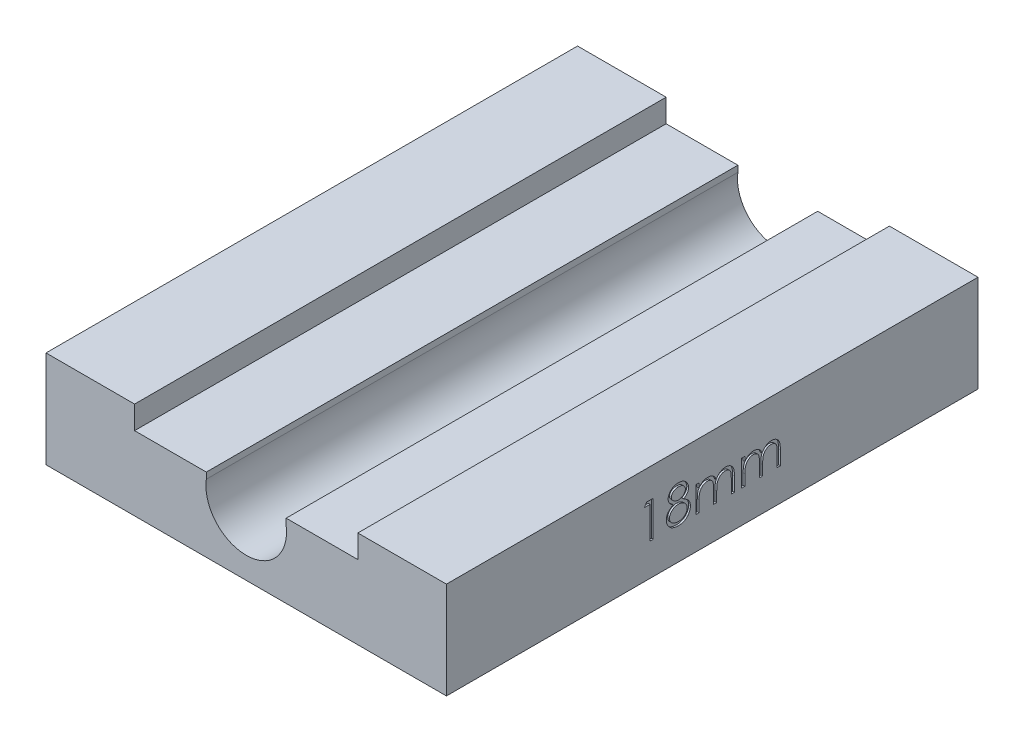
from build123d import *

# Parameters (mm, degrees)
BOSS_EXTRUDE1_DEPTH = 120
CUT_EXTRUDE1_DEPTH  = 0.4


with BuildPart() as part:
    # Sketch1 → Boss-Extrude1 (new body)
    with BuildSketch(Plane.XY):
        with BuildLine():
            ThreePointArc((9.1, 0), (-0.640273766, -9.077447301), (-9.00990099, 1.277373927))
            Line((-9.00990099, 1.277373927), (-9.00990099, 2.669343418))
            Line((-9.00990099, 2.669343418), (-25.2, 2.669343418))
            Line((-25.2, 2.669343418), (-25.2, 7.869343418))
            Line((-25.2, 7.869343418), (-45.2, 7.869343418))
            Line((-45.2, 7.869343418), (-45.2, -14))
            Line((-45.2, -14), (45.2, -14))
            Line((45.2, -14), (45.2, 7.869343418))
            Line((45.2, 7.869343418), (25.2, 7.869343418))
            Line((25.2, 7.869343418), (25.2, 2.669343418))
            Line((25.2, 2.669343418), (9.00990099, 2.669343418))
            Line((9.00990099, 2.669343418), (9.00990099, 1.277373927))
            ThreePointArc((9.00990099, 1.277373927), (9.077447301, 0.640273766), (9.1, 0))
        make_face()
    extrude(amount=BOSS_EXTRUDE1_DEPTH)

    # Sketch2 → Cut-Extrude1 (cut)
    # profile 1 of 4: a face of its own
    with BuildSketch(Plane(origin=(45.2, 0, 0), x_dir=(0, 0, -1), z_dir=(1, 0, 0))):
        Polygon((-74.817883643, 1.310632471), (-73.338716976, 1.310632471), (-73.338716976, -6.689367529), (-74.056665694, -6.689367529), (-74.056665694, 0.49011965), (-75.287434925, 0.49011965), align=None)
    # profile 2 of 4: a face of its own
    with BuildSketch(Plane(origin=(45.2, 0, 0), x_dir=(0, 0, -1), z_dir=(1, 0, 0))):
        with BuildLine():
            add(Edge.make_bspline(
                [(-66.474934925, -2.23263676), (-66.409452531, -2.26678066), (-66.281739995, -2.333372666), (-66.099849233, -2.440597415), (-65.933620659, -2.553605335), (-65.778442232, -2.667058728), (-65.637040287, -2.785302502), (-65.510995915, -2.908806859), (-65.397195641, -3.03448902), (-65.297934421, -3.164477226), (-65.210627365, -3.298426138), (-65.135171056, -3.436687334), (-65.070674593, -3.578957811), (-65.019559304, -3.726790565), (-64.977452352, -3.878014021), (-64.94847954, -4.034580836), (-64.932898014, -4.19545933), (-64.929952154, -4.304186876), (-64.928460566, -4.359239324)],
                knots=[0, 0, 0, 0, 1.272397273, 2.481599622, 3.635517121, 4.734568067, 5.792894095, 6.808321871, 7.773003508, 8.711915296, 9.623354172, 10.525449501, 11.423591555, 12.311487226, 13.218079475, 14.126165749, 15.051214107, 16, 16, 16, 16], degree=3))
            add(Edge.make_bspline(
                [(-64.928460566, -4.359239324), (-64.930223813, -4.436262713), (-64.93371394, -4.5887209), (-64.964113903, -4.813740584), (-65.009629283, -5.032281799), (-65.076096739, -5.244296636), (-65.162298776, -5.448615203), (-65.268531544, -5.6454124), (-65.388785727, -5.837913678), (-65.485362274, -5.956358024), (-65.534229796, -6.016290606)],
                knots=[0, 0, 0, 0, 1.025265484, 2.029385089, 3.018602448, 3.995076438, 4.983346944, 5.966715145, 6.97116228, 8, 8, 8, 8], degree=3))
            add(Edge.make_bspline(
                [(-65.534229796, -6.016290606), (-65.597856023, -6.086219233), (-65.724322231, -6.225212359), (-65.940968922, -6.405671353), (-66.178733228, -6.557327111), (-66.436695131, -6.680920013), (-66.714165077, -6.777116262), (-67.011083945, -6.846242017), (-67.32803058, -6.885836141), (-67.545871657, -6.891559546), (-67.657627232, -6.894495735)],
                knots=[0, 0, 0, 0, 0.954267603, 1.896743057, 2.838368354, 3.796610408, 4.779680527, 5.799409237, 6.871065594, 8, 8, 8, 8], degree=3))
            add(Edge.make_bspline(
                [(-67.657627232, -6.894495735), (-67.765086406, -6.891861499), (-67.974191044, -6.886735545), (-68.278551907, -6.852005416), (-68.562261781, -6.79114172), (-68.82697028, -6.707839756), (-69.071081579, -6.59947352), (-69.293900096, -6.464597157), (-69.498640604, -6.308639575), (-69.679089686, -6.127121682), (-69.839291844, -5.932703688), (-69.980018822, -5.73212858), (-70.096988145, -5.525378049), (-70.196021505, -5.315534924), (-70.271834129, -5.099658), (-70.324342038, -4.87885797), (-70.357689041, -4.6535205), (-70.362125921, -4.50144815), (-70.364358002, -4.424944452)],
                knots=[0, 0, 0, 0, 1.256902934, 2.445805442, 3.576955095, 4.645999104, 5.686449165, 6.692658513, 7.68621702, 8.689161843, 9.678783111, 10.630372946, 11.551080876, 12.453998257, 13.34127905, 14.221779781, 15.105423033, 16, 16, 16, 16], degree=3))
            add(Edge.make_bspline(
                [(-70.364358002, -4.424944452), (-70.363037131, -4.368809156), (-70.360426624, -4.257865998), (-70.342358399, -4.093958962), (-70.313310487, -3.934424939), (-70.273860301, -3.778674668), (-70.220395097, -3.627842045), (-70.15584165, -3.481212391), (-70.080568616, -3.338620165), (-69.993525953, -3.19928558), (-69.892264184, -3.06516098), (-69.777604413, -2.933970135), (-69.647254999, -2.807748725), (-69.502666064, -2.684954611), (-69.345489974, -2.563409528), (-69.17164419, -2.449682148), (-68.985737292, -2.335721086), (-68.853610651, -2.26758777), (-68.785832361, -2.23263676)],
                knots=[0, 0, 0, 0, 0.941657376, 1.861047343, 2.762797495, 3.66048619, 4.553285746, 5.444104102, 6.34607688, 7.256116206, 8.197091036, 9.162375105, 10.176350973, 11.237807142, 12.343728897, 13.50695164, 14.721116704, 16, 16, 16, 16], degree=3))
            add(Edge.make_bspline(
                [(-68.785832361, -2.23263676), (-68.878612646, -2.182043003), (-69.058261246, -2.084079329), (-69.296134255, -1.904086629), (-69.50045568, -1.709143053), (-69.66560932, -1.495132093), (-69.795602984, -1.268739237), (-69.884788366, -1.031380946), (-69.945123187, -0.787458401), (-69.951099934, -0.620815666), (-69.954101591, -0.53712394)],
                knots=[0, 0, 0, 0, 1.166880483, 2.259407225, 3.286803203, 4.280235371, 5.237608625, 6.161067461, 7.076446754, 8, 8, 8, 8], degree=3))
            add(Edge.make_bspline(
                [(-69.954101591, -0.53712394), (-69.950363479, -0.451872378), (-69.942849222, -0.28050187), (-69.882087346, -0.02540216), (-69.783070051, 0.225149989), (-69.648393487, 0.469940189), (-69.480651278, 0.700683537), (-69.279402031, 0.907634272), (-69.049451638, 1.08891766), (-68.791947942, 1.241091769), (-68.514836546, 1.364940132), (-68.222457748, 1.450376527), (-67.919905764, 1.506230508), (-67.71396812, 1.51255429), (-67.609550309, 1.515760676)],
                knots=[0, 0, 0, 0, 0.888701115, 1.786444228, 2.72001202, 3.692817113, 4.693886446, 5.687152267, 6.695133018, 7.739871481, 8.800368666, 9.853104506, 10.91144658, 12, 12, 12, 12], degree=3))
            add(Edge.make_bspline(
                [(-67.609550309, 1.515760676), (-67.507827304, 1.512454749), (-67.307241125, 1.505935837), (-67.012396262, 1.45156583), (-66.730282256, 1.360755499), (-66.461871973, 1.237561846), (-66.211970562, 1.085820267), (-65.991165283, 0.90204684), (-65.796119382, 0.69600901), (-65.634783624, 0.465335631), (-65.501839876, 0.221486046), (-65.409266388, -0.033651145), (-65.34994759, -0.294563279), (-65.342465615, -0.471107288), (-65.338716976, -0.559559837)],
                knots=[0, 0, 0, 0, 1.072916533, 2.115669174, 3.151510826, 4.193348718, 5.225979165, 6.227137561, 7.216255879, 8.211077061, 9.189680878, 10.138522389, 11.067357538, 12, 12, 12, 12], degree=3))
            add(Edge.make_bspline(
                [(-65.338716976, -0.559559837), (-65.341995972, -0.64636364), (-65.348435733, -0.816841376), (-65.402607023, -1.065359137), (-65.493837454, -1.298095226), (-65.618395541, -1.517690545), (-65.780739513, -1.72016254), (-65.978702331, -1.908085899), (-66.21070571, -2.083004364), (-66.385016307, -2.181716054), (-66.474934925, -2.23263676)],
                knots=[0, 0, 0, 0, 0.975232327, 1.915300861, 2.843280834, 3.77672583, 4.742871857, 5.749627742, 6.839139064, 8, 8, 8, 8], degree=3))
        make_face()
        with BuildLine():
            add(Edge.make_bspline(
                [(-67.649614412, 0.695247855), (-67.70573054, 0.693758848), (-67.815518222, 0.690845699), (-67.976498042, 0.675625958), (-68.129577739, 0.646018605), (-68.276356712, 0.606615836), (-68.414822568, 0.553386149), (-68.546855836, 0.490768985), (-68.670209412, 0.414640835), (-68.786372391, 0.329243811), (-68.890945589, 0.235317169), (-68.983755993, 0.13745724), (-69.060848826, 0.033742058), (-69.126314219, -0.073248478), (-69.17381483, -0.186689795), (-69.209390382, -0.303103913), (-69.233439277, -0.423961934), (-69.235241311, -0.506559672), (-69.236152873, -0.548341888)],
                knots=[0, 0, 0, 0, 1.203892937, 2.355340988, 3.463153438, 4.544400666, 5.610487187, 6.640501085, 7.674077295, 8.714426146, 9.728707835, 10.68524104, 11.601827946, 12.495867327, 13.368432065, 14.231010473, 15.105153427, 16, 16, 16, 16], degree=3))
            add(Edge.make_bspline(
                [(-69.236152873, -0.548341888), (-69.234581749, -0.59012591), (-69.231476982, -0.67269714), (-69.20746526, -0.794630548), (-69.171678164, -0.914451432), (-69.115333795, -1.029310657), (-69.047753547, -1.143192621), (-68.964344459, -1.253251103), (-68.864940967, -1.359869126), (-68.752878246, -1.462139848), (-68.630794731, -1.55790845), (-68.501459775, -1.64104715), (-68.366496595, -1.710610832), (-68.227291865, -1.768506614), (-68.082426843, -1.813512185), (-67.932789189, -1.84544052), (-67.778353755, -1.865285084), (-67.673712428, -1.867655418), (-67.620768258, -1.868854709)],
                knots=[0, 0, 0, 0, 0.873023192, 1.725219244, 2.590779336, 3.480155217, 4.391973325, 5.357036234, 6.360879153, 7.436073238, 8.526419356, 9.601555421, 10.645666583, 11.697338044, 12.750135903, 13.812665442, 14.89329948, 16, 16, 16, 16], degree=3))
            add(Edge.make_bspline(
                [(-67.620768258, -1.868854709), (-67.552768021, -1.866859584), (-67.41743918, -1.86288904), (-67.217943565, -1.825972071), (-67.023971807, -1.767901402), (-66.837597168, -1.688450051), (-66.66364383, -1.588729228), (-66.508580817, -1.469339473), (-66.373730777, -1.333037536), (-66.260495096, -1.18194534), (-66.172701161, -1.02114171), (-66.104354172, -0.859769612), (-66.064442823, -0.69610737), (-66.059236955, -0.586468595), (-66.056665694, -0.532316247)],
                knots=[0, 0, 0, 0, 1.076279235, 2.141928126, 3.20205304, 4.278698113, 5.344010996, 6.36967002, 7.368914609, 8.37248503, 9.349703398, 10.264243087, 11.142681841, 12, 12, 12, 12], degree=3))
            add(Edge.make_bspline(
                [(-66.056665694, -0.532316247), (-66.05788146, -0.494309308), (-66.060294581, -0.418870981), (-66.080180423, -0.307469003), (-66.11303947, -0.198601384), (-66.15752651, -0.091368765), (-66.216063184, 0.012724337), (-66.285467041, 0.115314252), (-66.369774473, 0.214093141), (-66.464394892, 0.311362966), (-66.571698683, 0.401383592), (-66.691479054, 0.480548643), (-66.823121912, 0.547776887), (-66.966630369, 0.602379755), (-67.12147591, 0.64339084), (-67.286945337, 0.674102492), (-67.464418359, 0.691412461), (-67.586543504, 0.693941662), (-67.649614412, 0.695247855)],
                knots=[0, 0, 0, 0, 0.814439003, 1.616544685, 2.417341072, 3.248991801, 4.09997495, 4.973547432, 5.9003056, 6.880240646, 7.880314356, 8.896779544, 9.951930927, 11.043077905, 12.18215768, 13.381699519, 14.647792085, 16, 16, 16, 16], degree=3))
        make_face(mode=Mode.SUBTRACT)
        with BuildLine():
            add(Edge.make_bspline(
                [(-67.603140053, -2.689367529), (-67.674284706, -2.690632995), (-67.813853155, -2.693115531), (-68.018326133, -2.720748675), (-68.21456194, -2.759215859), (-68.401898938, -2.817572061), (-68.580258016, -2.893449753), (-68.750604719, -2.984728702), (-68.911635872, -3.092626857), (-69.061127818, -3.215773407), (-69.197638286, -3.348480731), (-69.317405829, -3.488965611), (-69.419114447, -3.634617114), (-69.50101902, -3.787285067), (-69.568245836, -3.943736749), (-69.612391842, -4.107868395), (-69.640692897, -4.276524654), (-69.644493197, -4.391176308), (-69.646409284, -4.448982914)],
                knots=[0, 0, 0, 0, 1.140299081, 2.23698856, 3.303958914, 4.344563908, 5.37730929, 6.408454204, 7.439741482, 8.480804886, 9.510774543, 10.48932336, 11.43758569, 12.353841022, 13.263987381, 14.161954604, 15.073269652, 16, 16, 16, 16], degree=3))
            add(Edge.make_bspline(
                [(-69.646409284, -4.448982914), (-69.643293264, -4.520824985), (-69.637111153, -4.663357976), (-69.588067407, -4.874016424), (-69.509357611, -5.077950264), (-69.399585689, -5.273497585), (-69.263659809, -5.456240685), (-69.096513597, -5.615529315), (-68.908534539, -5.757064123), (-68.693362301, -5.871533913), (-68.458325807, -5.962950725), (-68.20348757, -6.025935783), (-67.932504898, -6.067630525), (-67.745397259, -6.071832082), (-67.649614412, -6.073982914)],
                knots=[0, 0, 0, 0, 0.898778495, 1.783155532, 2.693654817, 3.627872908, 4.583023416, 5.533784346, 6.509005473, 7.520592997, 8.575161974, 9.658835044, 10.801527049, 12, 12, 12, 12], degree=3))
            add(Edge.make_bspline(
                [(-67.649614412, -6.073982914), (-67.574756428, -6.072545638), (-67.428909071, -6.069745362), (-67.216141187, -6.045026975), (-67.015353648, -6.005827833), (-66.826935823, -5.948814014), (-66.648778475, -5.879214068), (-66.483902237, -5.789677881), (-66.328065603, -5.687844), (-66.188947608, -5.567025357), (-66.062243131, -5.437929369), (-65.951767034, -5.301266413), (-65.85586406, -5.160750682), (-65.780593304, -5.013206717), (-65.72041901, -4.861465198), (-65.67716517, -4.704126887), (-65.650476678, -4.540709211), (-65.647777488, -4.429854192), (-65.646409284, -4.373662401)],
                knots=[0, 0, 0, 0, 1.224942928, 2.386581632, 3.501229538, 4.569074225, 5.605009692, 6.626002462, 7.634866581, 8.645888296, 9.63523824, 10.59253846, 11.518950513, 12.414518923, 13.29783783, 14.186679152, 15.080837789, 16, 16, 16, 16], degree=3))
            add(Edge.make_bspline(
                [(-65.646409284, -4.373662401), (-65.648479795, -4.319085623), (-65.65256248, -4.211469749), (-65.678474918, -4.052003402), (-65.723996923, -3.897939827), (-65.786459544, -3.747425528), (-65.86961603, -3.603510212), (-65.967547162, -3.462444678), (-66.085705147, -3.328144233), (-66.219219653, -3.199565728), (-66.364725849, -3.080672615), (-66.519393608, -2.975496755), (-66.682032379, -2.88692049), (-66.852298004, -2.814882786), (-67.029812417, -2.758225713), (-67.214445054, -2.718646295), (-67.406412082, -2.693732917), (-67.536823215, -2.690839098), (-67.603140053, -2.689367529)],
                knots=[0, 0, 0, 0, 0.917430815, 1.809013306, 2.70690318, 3.612392954, 4.541220862, 5.495268465, 6.494511384, 7.542276156, 8.608045339, 9.649016899, 10.681629292, 11.715607085, 12.752076957, 13.808767841, 14.885711793, 16, 16, 16, 16], degree=3))
        make_face(mode=Mode.SUBTRACT)
    # profile 3 of 4: a face of its own
    with BuildSketch(Plane(origin=(45.2, 0, 0), x_dir=(0, 0, -1), z_dir=(1, 0, 0))):
        with BuildLine():
            Line((-63.697691335, -0.843213683), (-62.979742617, -0.843213683))
            Line((-62.979742617, -0.843213683), (-62.979742617, -1.859239324))
            add(Edge.make_bspline(
                [(-62.979742617, -1.859239324), (-62.915093589, -1.770353377), (-62.791219852, -1.600039382), (-62.588098361, -1.375604447), (-62.385181532, -1.185140093), (-62.239048088, -1.085156386), (-62.168845181, -1.03712394)],
                knots=[0, 0, 0, 0, 1.134379233, 2.173579362, 3.122582517, 4, 4, 4, 4], degree=3))
            add(Edge.make_bspline(
                [(-62.168845181, -1.03712394), (-62.073154525, -0.991397391), (-61.88344504, -0.900743189), (-61.58305824, -0.808780768), (-61.275687567, -0.752266251), (-61.068125935, -0.744537397), (-60.963716976, -0.740649581)],
                knots=[0, 0, 0, 0, 1.014936303, 2.012140481, 3.000054389, 4, 4, 4, 4], degree=3))
            add(Edge.make_bspline(
                [(-60.963716976, -0.740649581), (-60.893104412, -0.743038817), (-60.753365946, -0.747766986), (-60.546316597, -0.778532781), (-60.345496913, -0.831712605), (-60.152093417, -0.905786489), (-59.969874722, -0.995493202), (-59.802813698, -1.100749677), (-59.652815508, -1.218914421), (-59.519955963, -1.35532341), (-59.400483904, -1.513807064), (-59.290589398, -1.698639633), (-59.189046055, -1.91397143), (-59.132768778, -2.070237809), (-59.103140053, -2.152508555)],
                knots=[0, 0, 0, 0, 1.009824226, 1.998387844, 2.986035974, 3.974953746, 4.955485308, 5.885931332, 6.793869504, 7.679848016, 8.601185859, 9.625726857, 10.749998409, 12, 12, 12, 12], degree=3))
            add(Edge.make_bspline(
                [(-59.103140053, -2.152508555), (-59.07180005, -2.095995597), (-59.010127325, -1.984786031), (-58.906571583, -1.827395717), (-58.798073763, -1.680180193), (-58.683709207, -1.543022652), (-58.56388158, -1.416600411), (-58.438026951, -1.300495493), (-58.306861736, -1.19420929), (-58.124479473, -1.070042068), (-57.887193514, -0.938153654), (-57.58802068, -0.823802925), (-57.276820288, -0.753137488), (-57.065579835, -0.744839722), (-56.958909284, -0.740649581)],
                knots=[0, 0, 0, 0, 0.86119277, 1.694706429, 2.50939023, 3.298075842, 4.073795165, 4.829715201, 5.57930267, 6.321991688, 7.768977793, 9.186738141, 10.579381044, 12, 12, 12, 12], degree=3))
            add(Edge.make_bspline(
                [(-56.958909284, -0.740649581), (-56.860894512, -0.744346086), (-56.669070086, -0.751580504), (-56.389807764, -0.808388443), (-56.129369352, -0.905937351), (-55.888278892, -1.039042806), (-55.670770747, -1.206309511), (-55.481704898, -1.405323997), (-55.322229782, -1.634678564), (-55.218050034, -1.850431681), (-55.147386573, -2.040912441), (-55.103818037, -2.203212536), (-55.065327305, -2.381844657), (-55.033370173, -2.577022397), (-55.010013483, -2.789435216), (-54.99270899, -3.018735504), (-54.980996822, -3.265101474), (-54.980169228, -3.43507976), (-54.979742617, -3.522700863)],
                knots=[0, 0, 0, 0, 1.209669288, 2.367440248, 3.500751976, 4.631527125, 5.755587489, 6.87532382, 8.007944318, 9.190864318, 9.82315674, 10.514484317, 11.263564316, 12.079023757, 12.955305781, 13.901327259, 14.918167583, 16, 16, 16, 16], degree=3))
            Line((-54.979742617, -3.522700863), (-54.979742617, -6.689367529))
            Line((-54.979742617, -6.689367529), (-55.697691335, -6.689367529))
            Line((-55.697691335, -6.689367529), (-55.697691335, -3.519495735))
            add(Edge.make_bspline(
                [(-55.697691335, -3.519495735), (-55.697869353, -3.444705851), (-55.698211477, -3.30097107), (-55.704368349, -3.094679753), (-55.715969067, -2.906637793), (-55.729533956, -2.737101592), (-55.748376949, -2.58567579), (-55.772710507, -2.452664547), (-55.798488061, -2.33702155), (-55.841313183, -2.20882487), (-55.909765507, -2.067407246), (-56.014034033, -1.914896215), (-56.145394276, -1.782140101), (-56.297074634, -1.666898234), (-56.469756793, -1.573198482), (-56.66007616, -1.506281889), (-56.866851135, -1.464858167), (-57.009988937, -1.460730131), (-57.083909284, -1.458598299)],
                knots=[0, 0, 0, 0, 1.253487763, 2.409012846, 3.458416907, 4.410876679, 5.259312806, 6.014470957, 6.676830364, 7.243083969, 8.276244668, 9.299465089, 10.325150304, 11.392391894, 12.482080715, 13.603491619, 14.762376348, 16, 16, 16, 16], degree=3))
            add(Edge.make_bspline(
                [(-57.083909284, -1.458598299), (-57.174583465, -1.46183523), (-57.353790119, -1.468232636), (-57.615379802, -1.533544346), (-57.866742126, -1.63201349), (-58.100376715, -1.77471625), (-58.315297379, -1.945706795), (-58.5002107, -2.149020157), (-58.652969982, -2.379031419), (-58.756407641, -2.591938167), (-58.821754615, -2.78318261), (-58.864901851, -2.950262318), (-58.898463889, -3.140163044), (-58.929939384, -3.351608737), (-58.950482762, -3.586054864), (-58.969153328, -3.842416923), (-58.977886728, -4.121465973), (-58.979108348, -4.314898405), (-58.979742617, -4.415329068)],
                knots=[0, 0, 0, 0, 1.090531906, 2.155305635, 3.229839962, 4.33261226, 5.44038871, 6.529323825, 7.629011124, 8.757537029, 9.370236727, 10.061839251, 10.834451254, 11.692844982, 12.636905849, 13.66920014, 14.789842145, 16, 16, 16, 16], degree=3))
            Line((-58.979742617, -4.415329068), (-58.979742617, -6.689367529))
            Line((-58.979742617, -6.689367529), (-59.697691335, -6.689367529))
            Line((-59.697691335, -6.689367529), (-59.697691335, -3.716611119))
            add(Edge.make_bspline(
                [(-59.697691335, -3.716611119), (-59.697872891, -3.632740676), (-59.698222188, -3.471382374), (-59.704339485, -3.239991116), (-59.715966049, -3.029520076), (-59.729407302, -2.840213873), (-59.748744853, -2.67241655), (-59.770710023, -2.525228532), (-59.796649705, -2.399018815), (-59.839598012, -2.260588221), (-59.905231083, -2.108083254), (-60.010804253, -1.945475206), (-60.142478722, -1.803148126), (-60.296926439, -1.681642415), (-60.470653712, -1.581204744), (-60.662615771, -1.508839597), (-60.871084143, -1.466726935), (-61.014804614, -1.461358942), (-61.088716976, -1.458598299)],
                knots=[0, 0, 0, 0, 1.320475261, 2.540461679, 3.643808994, 4.639130445, 5.527981419, 6.302341397, 6.981980563, 7.553956391, 8.582137848, 9.585246428, 10.591171744, 11.620968678, 12.668337649, 13.738356861, 14.836885341, 16, 16, 16, 16], degree=3))
            add(Edge.make_bspline(
                [(-61.088716976, -1.458598299), (-61.175611174, -1.462096493), (-61.348788224, -1.46906827), (-61.603192726, -1.531820896), (-61.848874288, -1.630115924), (-62.0819136, -1.766481225), (-62.296025939, -1.935393404), (-62.483473407, -2.134056023), (-62.641056322, -2.359996671), (-62.745586185, -2.570658423), (-62.813011269, -2.757111623), (-62.857800605, -2.915628075), (-62.896291178, -3.091628642), (-62.924894657, -3.285656325), (-62.952507035, -3.496447397), (-62.965833456, -3.725051945), (-62.978797027, -3.97127386), (-62.979419689, -4.141268249), (-62.979742617, -4.229431632)],
                knots=[0, 0, 0, 0, 1.098833095, 2.189935336, 3.297829714, 4.440610912, 5.596351641, 6.740013378, 7.886572111, 9.072425424, 9.705826452, 10.395263256, 11.156850408, 11.985370555, 12.878090359, 13.847760091, 14.883794034, 16, 16, 16, 16], degree=3))
            Line((-62.979742617, -4.229431632), (-62.979742617, -6.689367529))
            Line((-62.979742617, -6.689367529), (-63.697691335, -6.689367529))
            Line((-63.697691335, -6.689367529), (-63.697691335, -0.843213683))
        make_face()
    # profile 4 of 4: a face of its own
    with BuildSketch(Plane(origin=(45.2, 0, 0), x_dir=(0, 0, -1), z_dir=(1, 0, 0))):
        with BuildLine():
            Line((-53.338716976, -0.843213683), (-52.620768258, -0.843213683))
            Line((-52.620768258, -0.843213683), (-52.620768258, -1.859239324))
            add(Edge.make_bspline(
                [(-52.620768258, -1.859239324), (-52.55611923, -1.770353377), (-52.432245493, -1.600039382), (-52.229124002, -1.375604447), (-52.026207173, -1.185140093), (-51.880073729, -1.085156386), (-51.809870822, -1.03712394)],
                knots=[0, 0, 0, 0, 1.134379233, 2.173579362, 3.122582517, 4, 4, 4, 4], degree=3))
            add(Edge.make_bspline(
                [(-51.809870822, -1.03712394), (-51.714180166, -0.991397391), (-51.524470681, -0.900743189), (-51.224083881, -0.808780768), (-50.916713208, -0.752266251), (-50.709151576, -0.744537397), (-50.604742617, -0.740649581)],
                knots=[0, 0, 0, 0, 1.014936303, 2.012140481, 3.000054389, 4, 4, 4, 4], degree=3))
            add(Edge.make_bspline(
                [(-50.604742617, -0.740649581), (-50.534130053, -0.743038817), (-50.394391587, -0.747766986), (-50.187342238, -0.778532781), (-49.986522554, -0.831712605), (-49.793119058, -0.905786489), (-49.610900363, -0.995493202), (-49.44383934, -1.100749677), (-49.293841149, -1.218914421), (-49.160981604, -1.35532341), (-49.041509545, -1.513807064), (-48.931615039, -1.698639633), (-48.830071696, -1.91397143), (-48.773794419, -2.070237809), (-48.744165694, -2.152508555)],
                knots=[0, 0, 0, 0, 1.009824226, 1.998387844, 2.986035974, 3.974953746, 4.955485308, 5.885931332, 6.793869504, 7.679848016, 8.601185859, 9.625726857, 10.749998409, 12, 12, 12, 12], degree=3))
            add(Edge.make_bspline(
                [(-48.744165694, -2.152508555), (-48.712825691, -2.095995597), (-48.651152966, -1.984786031), (-48.547597224, -1.827395717), (-48.439099404, -1.680180193), (-48.324734848, -1.543022652), (-48.204907221, -1.416600411), (-48.079052592, -1.300495493), (-47.947887377, -1.19420929), (-47.765505114, -1.070042068), (-47.528219155, -0.938153654), (-47.229046321, -0.823802925), (-46.917845929, -0.753137488), (-46.706605476, -0.744839722), (-46.599934925, -0.740649581)],
                knots=[0, 0, 0, 0, 0.86119277, 1.694706429, 2.50939023, 3.298075842, 4.073795165, 4.829715201, 5.57930267, 6.321991688, 7.768977793, 9.186738141, 10.579381044, 12, 12, 12, 12], degree=3))
            add(Edge.make_bspline(
                [(-46.599934925, -0.740649581), (-46.501920153, -0.744346086), (-46.310095727, -0.751580504), (-46.030833405, -0.808388443), (-45.770394993, -0.905937351), (-45.529304533, -1.039042806), (-45.311796388, -1.206309511), (-45.122730539, -1.405323997), (-44.963255423, -1.634678564), (-44.859075675, -1.850431681), (-44.788412214, -2.040912441), (-44.744843678, -2.203212536), (-44.706352946, -2.381844657), (-44.674395814, -2.577022397), (-44.651039124, -2.789435216), (-44.633734631, -3.018735504), (-44.622022463, -3.265101474), (-44.621194869, -3.43507976), (-44.620768258, -3.522700863)],
                knots=[0, 0, 0, 0, 1.209669288, 2.367440248, 3.500751976, 4.631527125, 5.755587489, 6.87532382, 8.007944318, 9.190864318, 9.82315674, 10.514484317, 11.263564316, 12.079023757, 12.955305781, 13.901327259, 14.918167583, 16, 16, 16, 16], degree=3))
            Line((-44.620768258, -3.522700863), (-44.620768258, -6.689367529))
            Line((-44.620768258, -6.689367529), (-45.338716976, -6.689367529))
            Line((-45.338716976, -6.689367529), (-45.338716976, -3.519495735))
            add(Edge.make_bspline(
                [(-45.338716976, -3.519495735), (-45.338894994, -3.444705851), (-45.339237118, -3.30097107), (-45.34539399, -3.094679753), (-45.356994708, -2.906637793), (-45.370559597, -2.737101592), (-45.38940259, -2.58567579), (-45.413736148, -2.452664547), (-45.439513702, -2.33702155), (-45.482338824, -2.20882487), (-45.550791148, -2.067407246), (-45.655059674, -1.914896215), (-45.786419917, -1.782140101), (-45.938100275, -1.666898234), (-46.110782434, -1.573198482), (-46.301101801, -1.506281889), (-46.507876776, -1.464858167), (-46.651014578, -1.460730131), (-46.724934925, -1.458598299)],
                knots=[0, 0, 0, 0, 1.253487763, 2.409012846, 3.458416907, 4.410876679, 5.259312806, 6.014470957, 6.676830364, 7.243083969, 8.276244668, 9.299465089, 10.325150304, 11.392391894, 12.482080715, 13.603491619, 14.762376348, 16, 16, 16, 16], degree=3))
            add(Edge.make_bspline(
                [(-46.724934925, -1.458598299), (-46.815609106, -1.46183523), (-46.99481576, -1.468232636), (-47.256405443, -1.533544346), (-47.507767767, -1.63201349), (-47.741402356, -1.77471625), (-47.956323021, -1.945706795), (-48.141236341, -2.149020157), (-48.293995623, -2.379031419), (-48.397433282, -2.591938167), (-48.462780256, -2.78318261), (-48.505927492, -2.950262318), (-48.53948953, -3.140163044), (-48.570965025, -3.351608737), (-48.591508403, -3.586054864), (-48.610178969, -3.842416923), (-48.618912369, -4.121465973), (-48.620133989, -4.314898405), (-48.620768258, -4.415329068)],
                knots=[0, 0, 0, 0, 1.090531906, 2.155305635, 3.229839962, 4.33261226, 5.44038871, 6.529323825, 7.629011124, 8.757537029, 9.370236727, 10.061839251, 10.834451254, 11.692844982, 12.636905849, 13.66920014, 14.789842145, 16, 16, 16, 16], degree=3))
            Line((-48.620768258, -4.415329068), (-48.620768258, -6.689367529))
            Line((-48.620768258, -6.689367529), (-49.338716976, -6.689367529))
            Line((-49.338716976, -6.689367529), (-49.338716976, -3.716611119))
            add(Edge.make_bspline(
                [(-49.338716976, -3.716611119), (-49.338898532, -3.632740676), (-49.339247829, -3.471382374), (-49.345365126, -3.239991116), (-49.35699169, -3.029520076), (-49.370432943, -2.840213873), (-49.389770494, -2.67241655), (-49.411735664, -2.525228532), (-49.437675346, -2.399018815), (-49.480623653, -2.260588221), (-49.546256724, -2.108083254), (-49.651829894, -1.945475206), (-49.783504363, -1.803148126), (-49.93795208, -1.681642415), (-50.111679353, -1.581204744), (-50.303641412, -1.508839597), (-50.512109784, -1.466726935), (-50.655830255, -1.461358942), (-50.729742617, -1.458598299)],
                knots=[0, 0, 0, 0, 1.320475261, 2.540461679, 3.643808994, 4.639130445, 5.527981419, 6.302341397, 6.981980563, 7.553956391, 8.582137848, 9.585246428, 10.591171744, 11.620968678, 12.668337649, 13.738356861, 14.836885341, 16, 16, 16, 16], degree=3))
            add(Edge.make_bspline(
                [(-50.729742617, -1.458598299), (-50.816636815, -1.462096493), (-50.989813865, -1.46906827), (-51.244218367, -1.531820896), (-51.489899929, -1.630115924), (-51.722939241, -1.766481225), (-51.93705158, -1.935393404), (-52.124499048, -2.134056023), (-52.282081963, -2.359996671), (-52.386611826, -2.570658423), (-52.45403691, -2.757111623), (-52.498826246, -2.915628075), (-52.537316819, -3.091628642), (-52.565920298, -3.285656325), (-52.593532676, -3.496447397), (-52.606859097, -3.725051945), (-52.619822668, -3.97127386), (-52.62044533, -4.141268249), (-52.620768258, -4.229431632)],
                knots=[0, 0, 0, 0, 1.098833095, 2.189935336, 3.297829714, 4.440610912, 5.596351641, 6.740013378, 7.886572111, 9.072425424, 9.705826452, 10.395263256, 11.156850408, 11.985370555, 12.878090359, 13.847760091, 14.883794034, 16, 16, 16, 16], degree=3))
            Line((-52.620768258, -4.229431632), (-52.620768258, -6.689367529))
            Line((-52.620768258, -6.689367529), (-53.338716976, -6.689367529))
            Line((-53.338716976, -6.689367529), (-53.338716976, -0.843213683))
        make_face()
    extrude(amount=-CUT_EXTRUDE1_DEPTH, mode=Mode.SUBTRACT)


solid = part.part
